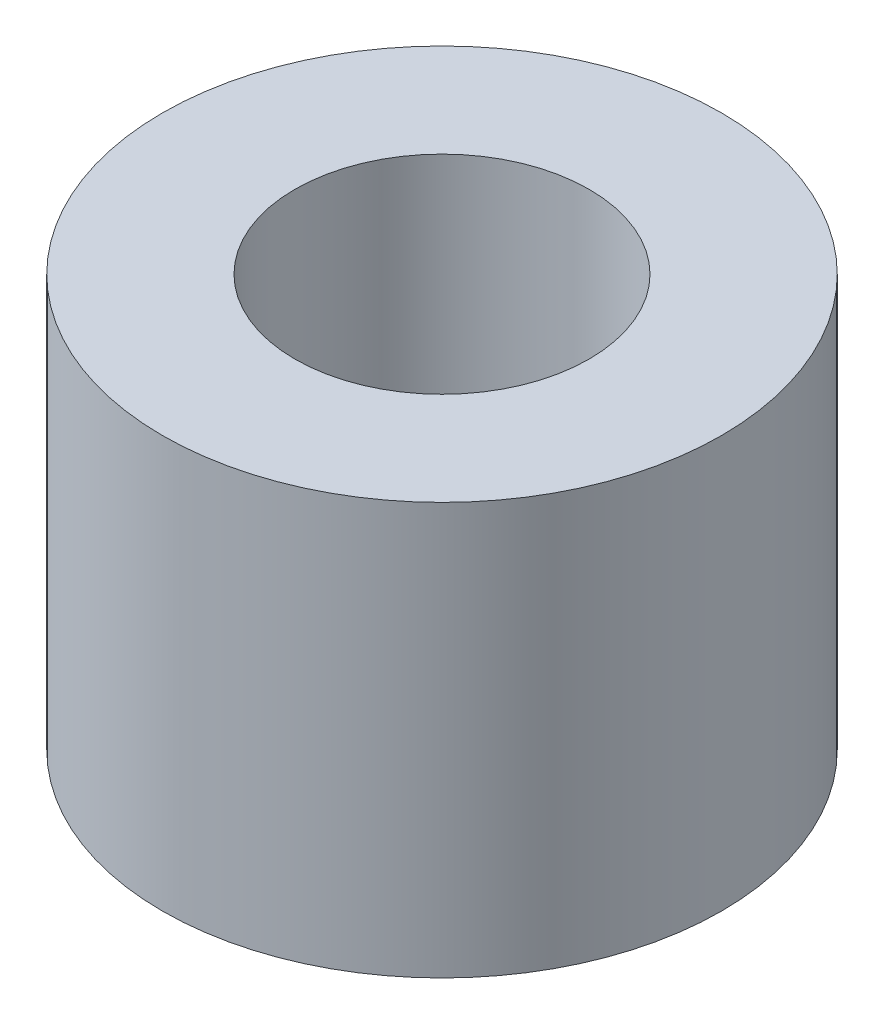
from build123d import *

# Parameters (mm, degrees)
SKETCH1_R           = 9.5
SKETCH1_R_2         = 5
BOSS_EXTRUDE1_DEPTH = 14


with BuildPart() as part:
    # Sketch1 → Boss-Extrude1 (new body)
    with BuildSketch(Plane(origin=(0, 0, 0), x_dir=(1, 0, 0), z_dir=(0, 1, 0))):
        with Locations(Location((0, 0, 0), (0, 0, 270))):
            Circle(SKETCH1_R)
        with Locations(Location((0, 0, 0), (0, 0, 270))):
            Circle(SKETCH1_R_2, mode=Mode.SUBTRACT)
    extrude(amount=BOSS_EXTRUDE1_DEPTH)


solid = part.part
